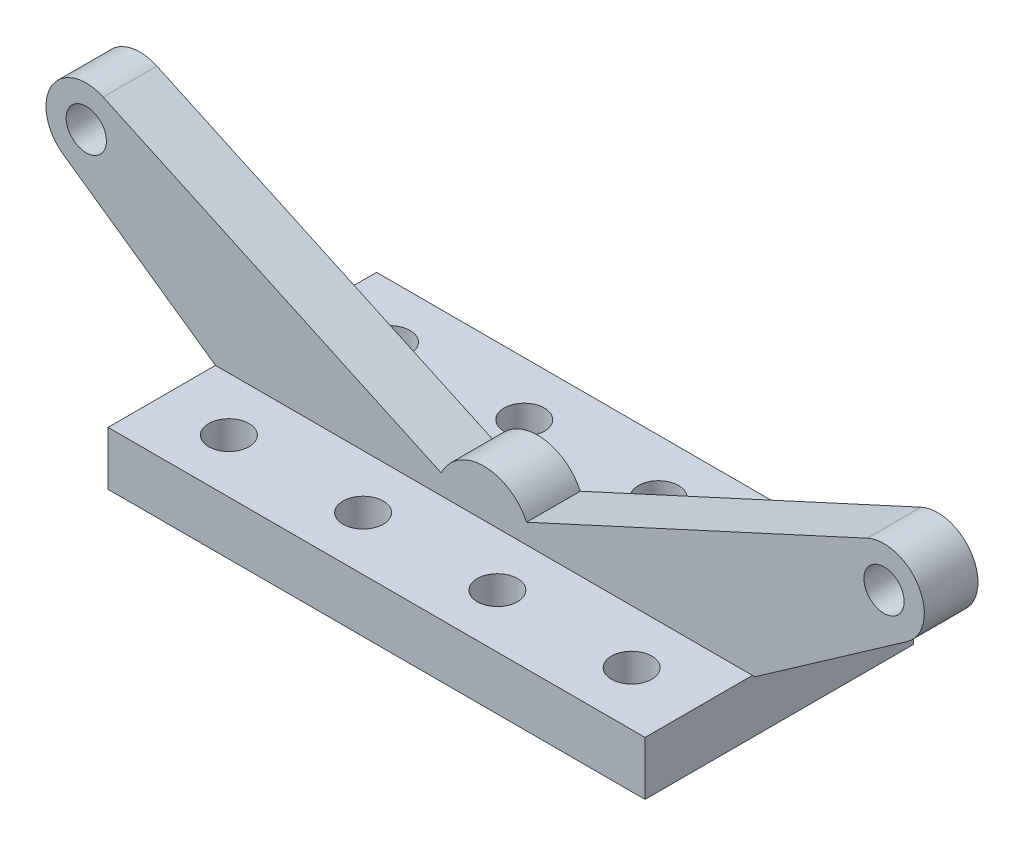
from build123d import *

# Parameters (mm, degrees)
BOSS_EXTRUDE1_DEPTH      = 50
BOSS_EXTRUDE1_DEPTH_BACK = 50
SKETCH1_W                = 200
SKETCH1_H                = 20
BOSS_EXTRUDE2_DEPTH      = 10
BOSS_EXTRUDE2_DEPTH_BACK = 10
HOLE1_D                  = 15
HOLE2_D                  = 15
LPATTERN1_COUNT          = 4
LPATTERN1_PITCH          = 50
MIRROR1_COPY_1_D         = 15
MIRROR1_COPY_2_D         = 15
MIRROR1_COPY_3_D         = 15


with BuildPart() as part:
    # Sketch1 → Boss-Extrude1 (new, two sides: drawn at the far end of the back side and taken through both)
    with BuildSketch(Plane.XY.offset(-BOSS_EXTRUDE1_DEPTH_BACK)):
        with Locations((0, 10)):
            Rectangle(SKETCH1_W, SKETCH1_H)
    extrude(amount=BOSS_EXTRUDE1_DEPTH + BOSS_EXTRUDE1_DEPTH_BACK)

    # Sketch2 → Boss-Extrude2 (add, two sides: drawn at the far end of the back side and taken through both)
    with BuildSketch(Plane.XY.offset(-BOSS_EXTRUDE2_DEPTH_BACK)):
        with BuildLine():
            Line((-141.813369554, 85.613497892), (-15.882414207, 27.348395672))
            ThreePointArc((-15.882414207, 27.348395672), (0, 37.5), (15.882414207, 27.348395672))
            Line((15.882414207, 27.348395672), (142.737764558, 85.630275392))
            ThreePointArc((142.737764558, 85.630275392), (162.01155177, 79.46321114), (157.603646545, 59.712719336))
            Line((157.603646545, 59.712719336), (100.888005584, 20))
            Line((100.888005584, 20), (-100, 20))
            Line((-100, 20), (-156.715640962, 59.712719336))
            ThreePointArc((-156.715640962, 59.712719336), (-161.113566002, 79.480583955), (-141.813369554, 85.613497892))
        make_face()
    extrude(amount=BOSS_EXTRUDE2_DEPTH + BOSS_EXTRUDE2_DEPTH_BACK)

    # Hole1 (through all)
    with Locations(Plane.XY.offset(10)):
        with Locations((-148.111994416, 72), (149, 72)):
            Hole(HOLE1_D / 2)

    # Hole2 (through all)
    with Locations(Plane(origin=(0, 20, 0), x_dir=(1, 0, 0), z_dir=(0, 1, 0))):
        with Locations((75, -30)):
            hole2 = Hole(HOLE2_D / 2)

    # LPattern1: Hole2 ×4
    with Locations(*[(-i * LPATTERN1_PITCH, 0, 0) for i in range(1, LPATTERN1_COUNT)]):
        add(hole2, mode=Mode.SUBTRACT)

    # Mirror1: Hole2 across plane
    add(hole2.mirror(Plane.XY), mode=Mode.SUBTRACT)

    # Mirror1 copy 1 (through all)
    with Locations(Plane(origin=(-50, 20, 0), x_dir=(1, 0, 0), z_dir=(0, 1, 0))):
        with Locations((75, 30)):
            Hole(MIRROR1_COPY_1_D / 2)

    # Mirror1 copy 2 (through all)
    with Locations(Plane(origin=(-100, 20, 0), x_dir=(1, 0, 0), z_dir=(0, 1, 0))):
        with Locations((75, 30)):
            Hole(MIRROR1_COPY_2_D / 2)

    # Mirror1 copy 3 (through all)
    with Locations(Plane(origin=(-150, 20, 0), x_dir=(1, 0, 0), z_dir=(0, 1, 0))):
        with Locations((75, 30)):
            Hole(MIRROR1_COPY_3_D / 2)


solid = part.part
